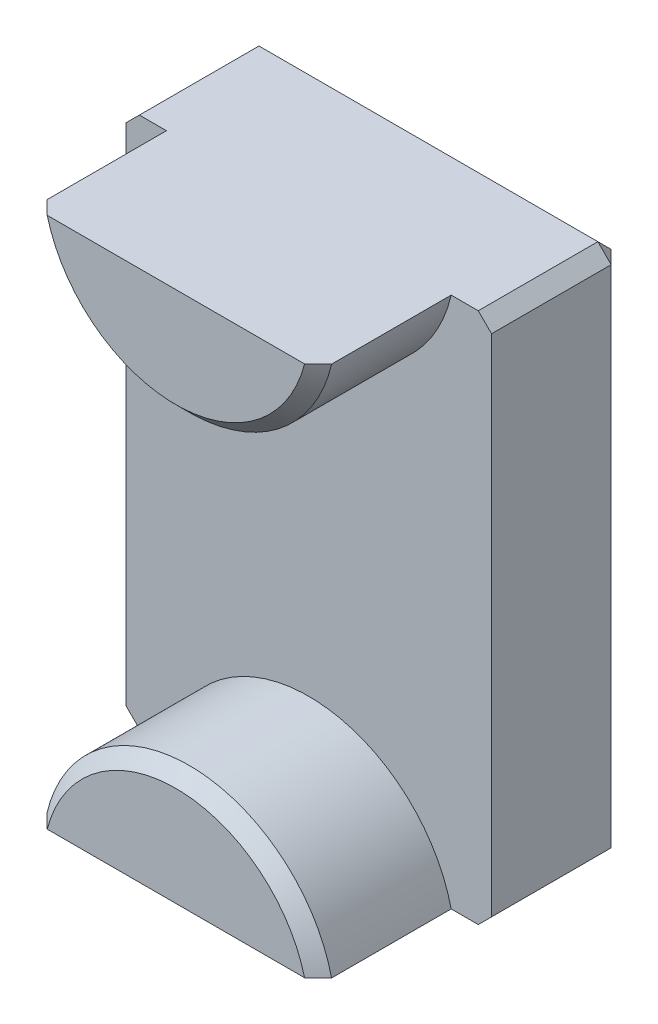
from build123d import *

# Parameters (mm, degrees)
SKETCH1_W           = 5.5
SKETCH1_H           = 8
BOSS_EXTRUDE1_DEPTH = 2
SLOT_TAB_DEPTH      = 2
DEBURS_SIZE         = 0.2


with BuildPart() as part:
    # Sketch1 → Boss-Extrude1 (new body)
    with BuildSketch(Plane.XY):
        Rectangle(SKETCH1_W, SKETCH1_H)
    extrude(amount=-BOSS_EXTRUDE1_DEPTH)

    # Sketch2 → Slot Tab (add)
    with BuildSketch(Plane.XY):
        with BuildLine():
            ThreePointArc((-2.142428529, 4), (0, 2.3), (2.142428529, 4))
            Line((2.142428529, 4), (-2.142428529, 4))
        make_face()
    slot_tab = extrude(amount=SLOT_TAB_DEPTH)

    # Slot Tabs: Slot Tab across plane
    add(slot_tab.mirror(Plane.ZX))

    # Deburs
    deburs_edges = [part.edges().sort_by_distance(p)[0] for p in [
        (-2.75, 0, -2),
        (0, 2.3, 2),
        (0, -4, -2),
        (0, -2.3, 2),
        (2.75, 0, -2),
        (2.75, -4, -1),
        (-2.75, -4, -1),
        (-2.75, 4, -1),
        (2.75, 4, -1),
        (0, 4, -2),
    ]]
    chamfer(deburs_edges, length=DEBURS_SIZE)


solid = part.part
